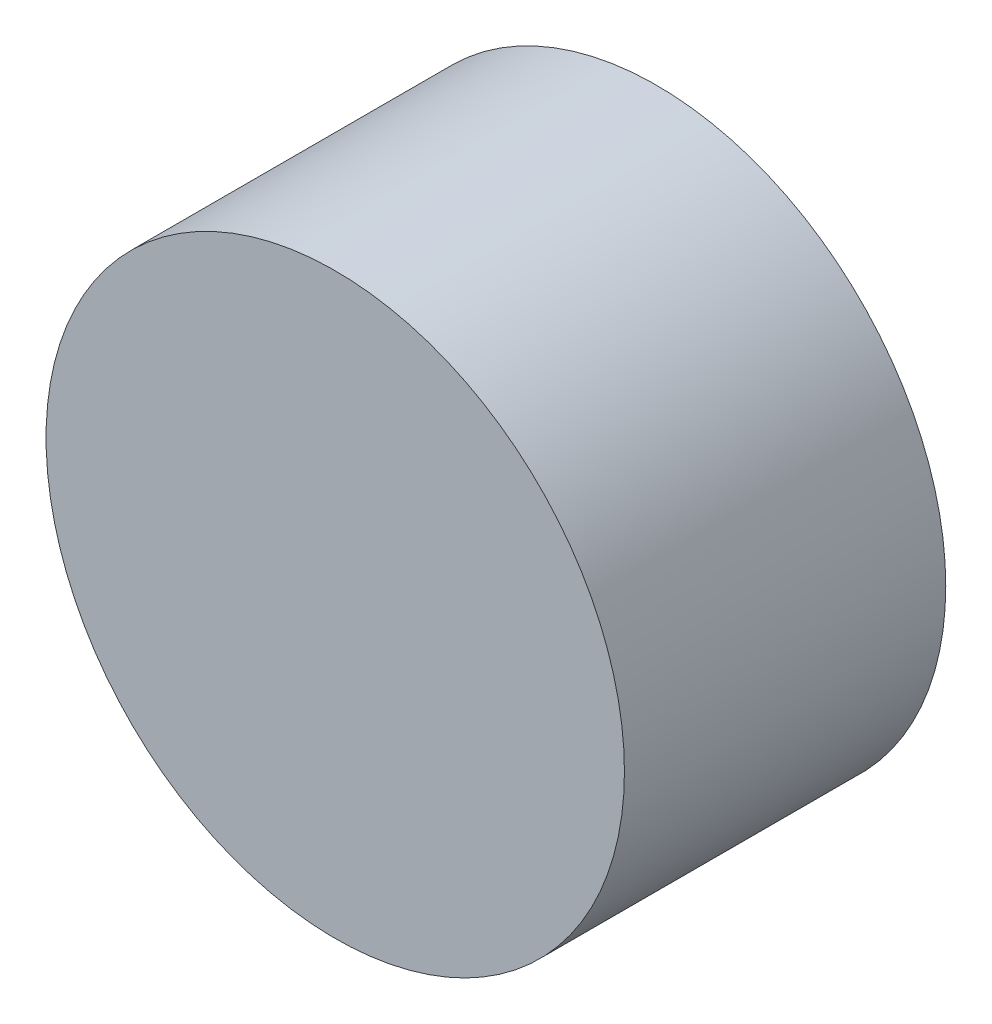
from build123d import *

# Parameters (mm, degrees)
SKETCH_1_R      = 18
EXTRUDE_1_DEPTH = 20
SCALE_1_SCALE   = 0.8


with BuildPart() as part:
    # 草图1 → 凸台-拉伸1 (new body)
    with BuildSketch(Plane.XY):
        Circle(SKETCH_1_R)
    extrude(amount=EXTRUDE_1_DEPTH)


with BuildPart() as part_1:
    # 缩放比例1: scaled about (0, 0, 10)
    add(part.part.scale(SCALE_1_SCALE).moved(Location((0, 0, 2))))


solid = part_1.part
